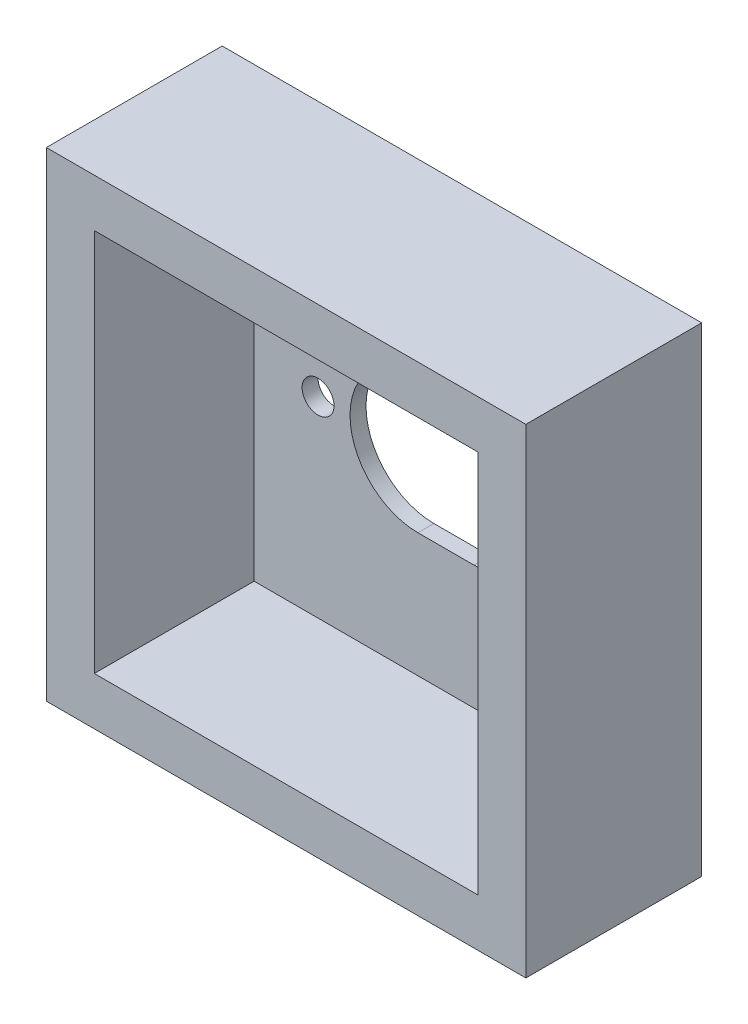
from build123d import *

# Parameters (mm, degrees)
CROQUIS1_W              = 30
CROQUIS1_H              = 30
CROQUIS1_R              = 1
SALIENTE_EXTRUIR2_DEPTH = 1
CROQUIS2_W              = 30
CROQUIS2_H              = 30
CROQUIS2_W_2            = 24
CROQUIS2_H_2            = 24
SALIENTE_EXTRUIR3_DEPTH = 10


with BuildPart() as part:
    # Croquis1 → Saliente-Extruir2 (new body)
    with BuildSketch(Plane.XY.offset(0.6)):
        Rectangle(CROQUIS1_W, CROQUIS1_H)
        with Locations((-8, 0)):
            Circle(CROQUIS1_R, mode=Mode.SUBTRACT)
        with Locations((8, 0)):
            Circle(CROQUIS1_R, mode=Mode.SUBTRACT)
        with BuildLine():
            Line((-1.75, 4.25), (1.75, 4.25))
            ThreePointArc((1.75, 4.25), (6, 0), (1.75, -4.25))
            Line((1.75, -4.25), (-1.75, -4.25))
            ThreePointArc((-1.75, -4.25), (-6, 0), (-1.75, 4.25))
        make_face(mode=Mode.SUBTRACT)
    extrude(amount=-SALIENTE_EXTRUIR2_DEPTH)

    # Croquis2 → Saliente-Extruir3 (add)
    with BuildSketch(Plane.XY.offset(0.6)):
        Rectangle(CROQUIS2_W, CROQUIS2_H)
        Rectangle(CROQUIS2_W_2, CROQUIS2_H_2, mode=Mode.SUBTRACT)
    extrude(amount=SALIENTE_EXTRUIR3_DEPTH)


solid = part.part
